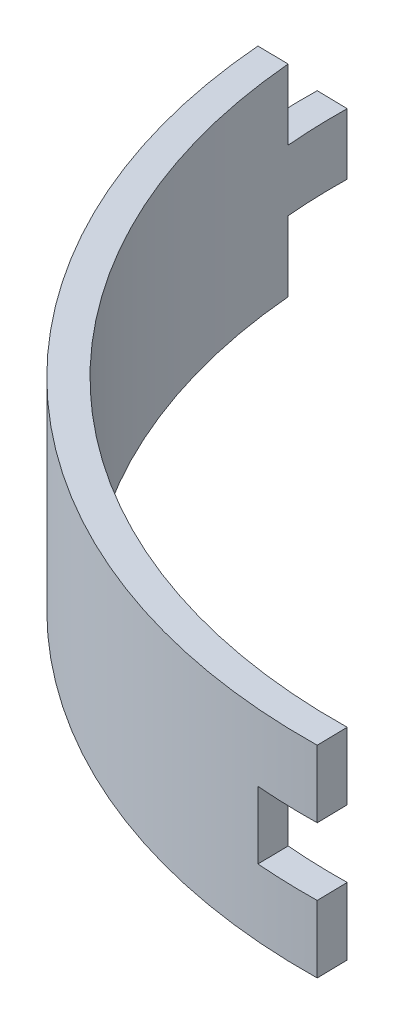
from build123d import *

# Parameters (mm, degrees)
BOSS_EXTRUDE3_DEPTH = 33
SKETCH3_W           = 10.19694267
SKETCH3_H           = 11
CUT_EXTRUDE1_DEPTH  = 10
SKETCH4_W           = 3.453847424
SKETCH4_H           = 11.5
SKETCH4_W_2         = 5
SKETCH4_W_3         = 11.907694848
CUT_EXTRUDE2_DEPTH  = 10.007450565


with BuildPart() as part:
    # Sketch1 → Boss-Extrude3 (new body)
    with BuildSketch(Plane(origin=(0, 0, 0), x_dir=(1, 0, 0), z_dir=(0, 1, 0))):
        with BuildLine():
            Line((-97.485150278, 1.701609628), (-102.484388754, 1.78887166))
            ThreePointArc((-102.484388754, 1.78887166), (-72.478445072, -72.478445072), (1.78887166, -102.484388754))
            Line((1.78887166, -102.484388754), (1.701609628, -97.485150278))
            ThreePointArc((1.701609628, -97.485150278), (-68.942911166, -68.942911166), (-97.485150278, 1.701609628))
        make_face()
    extrude(amount=BOSS_EXTRUDE3_DEPTH)

    # Sketch3 → Cut-Extrude1 (cut)
    with BuildSketch(Plane(origin=(0, 0, 0), x_dir=(-0.017452406437284955, 0, -0.9998476951563913), z_dir=(0.9998476951563912, 0, -0.01745240643728495))):
        with Locations((-100, 16.5)):
            Rectangle(SKETCH3_W, SKETCH3_H)
    extrude(amount=-CUT_EXTRUDE1_DEPTH, mode=Mode.SUBTRACT)

    # Sketch4 → Cut-Extrude2 (cut)
    with BuildSketch(Plane(origin=(0, 0, 0), x_dir=(-0.9998476951563914, 0, -0.01745240643727919), z_dir=(0.01745240643727919, 0, -0.9998476951563914))):
        with Locations((104.226923712, 5.75)):
            Rectangle(SKETCH4_W, SKETCH4_H)
        with Locations((95.773076288, 5.75)):
            Rectangle(SKETCH4_W, SKETCH4_H)
        with Locations((100, 5.75)):
            Rectangle(SKETCH4_W_2, SKETCH4_H)
        with Locations((100, 27.25)):
            Rectangle(SKETCH4_W_3, SKETCH4_H)
    extrude(amount=-CUT_EXTRUDE2_DEPTH, mode=Mode.SUBTRACT)


solid = part.part
